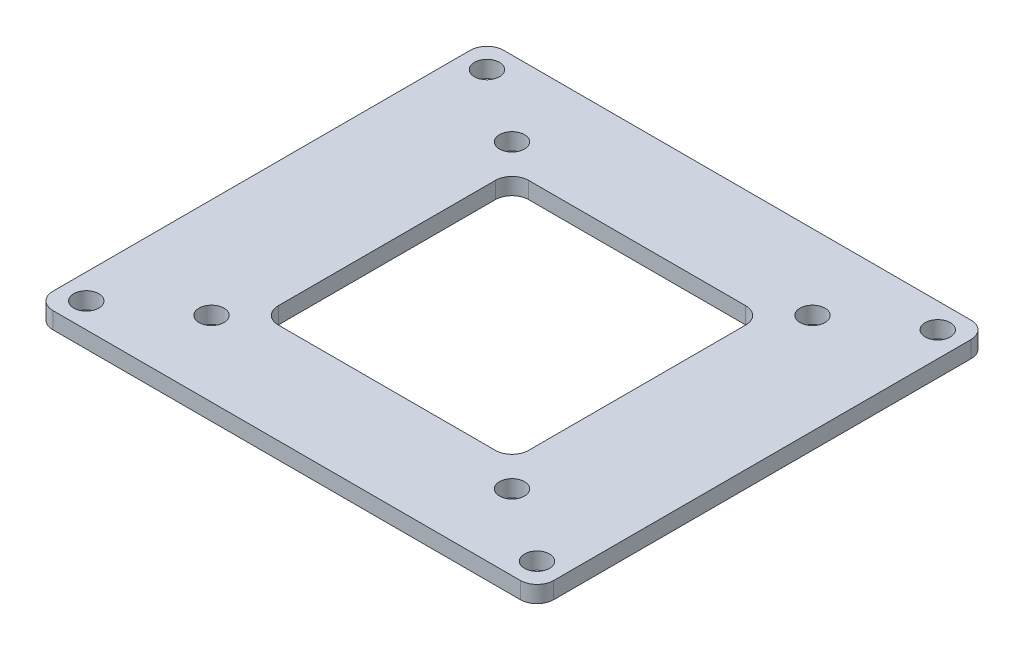
from build123d import *

# Parameters (mm, degrees)
SKETCH_1_W          = 60
SKETCH_1_H          = 54
SKETCH_1_R          = 1.5
EXTRUDE_1_DEPTH     = 2
SKETCH_2_R          = 1.5
CUT_EXTRUDE_1_DEPTH = 2
FILLET_1_R          = 2
SKETCH_3_W          = 30
SKETCH_3_H          = 30
CUT_EXTRUDE_2_DEPTH = 2
FILLET_2_R          = 2


with BuildPart() as part:
    # 草图1 → 凸台-拉伸1 (new body)
    with BuildSketch(Plane(origin=(0, 0, 0), x_dir=(1, 0, 0), z_dir=(0, 1, 0))):
        Rectangle(SKETCH_1_W, SKETCH_1_H)
        with Locations(Location((27, 24, 0), (0, 0, 270))):
            Circle(SKETCH_1_R, mode=Mode.SUBTRACT)
        with Locations(Location((-27, 24, 0), (0, 0, 90))):
            Circle(SKETCH_1_R, mode=Mode.SUBTRACT)
        with Locations(Location((-27, -24, 0), (0, 0, 270))):
            Circle(SKETCH_1_R, mode=Mode.SUBTRACT)
        with Locations(Location((27, -24, 0), (0, 0, 90))):
            Circle(SKETCH_1_R, mode=Mode.SUBTRACT)
    extrude(amount=EXTRUDE_1_DEPTH)

    # 草图2 → 切除-拉伸1 (cut)
    with BuildSketch(Plane(origin=(0, 2, 0), x_dir=(1, 0, 0), z_dir=(0, 1, 0))):
        with Locations(Location((18, 18, 0), (0, 0, 270))):
            Circle(SKETCH_2_R)
        with Locations(Location((-18, 18, 0), (0, 0, 90))):
            Circle(SKETCH_2_R)
        with Locations(Location((18, -18, 0), (0, 0, 90))):
            Circle(SKETCH_2_R)
        with Locations(Location((-18, -18, 0), (0, 0, 270))):
            Circle(SKETCH_2_R)
    extrude(amount=-CUT_EXTRUDE_1_DEPTH, mode=Mode.SUBTRACT)

    # 圆角1
    fillet_1_edges = [part.edges().sort_by_distance(p)[0] for p in [
        (30, 1, 27),
        (-30, 1, 27),
        (-30, 1, -27),
        (30, 1, -27),
    ]]
    fillet(fillet_1_edges, radius=FILLET_1_R)

    # 草图3 → 切除-拉伸2 (cut)
    with BuildSketch(Plane(origin=(0, 2, 0), x_dir=(1, 0, 0), z_dir=(0, 1, 0))):
        Rectangle(SKETCH_3_W, SKETCH_3_H)
    extrude(amount=-CUT_EXTRUDE_2_DEPTH, mode=Mode.SUBTRACT)

    # 圆角2
    fillet_2_edges = [part.edges().sort_by_distance(p)[0] for p in [
        (15, 1, -15),
        (15, 1, 15),
        (-15, 1, 15),
        (-15, 1, -15),
    ]]
    fillet(fillet_2_edges, radius=FILLET_2_R)


solid = part.part
